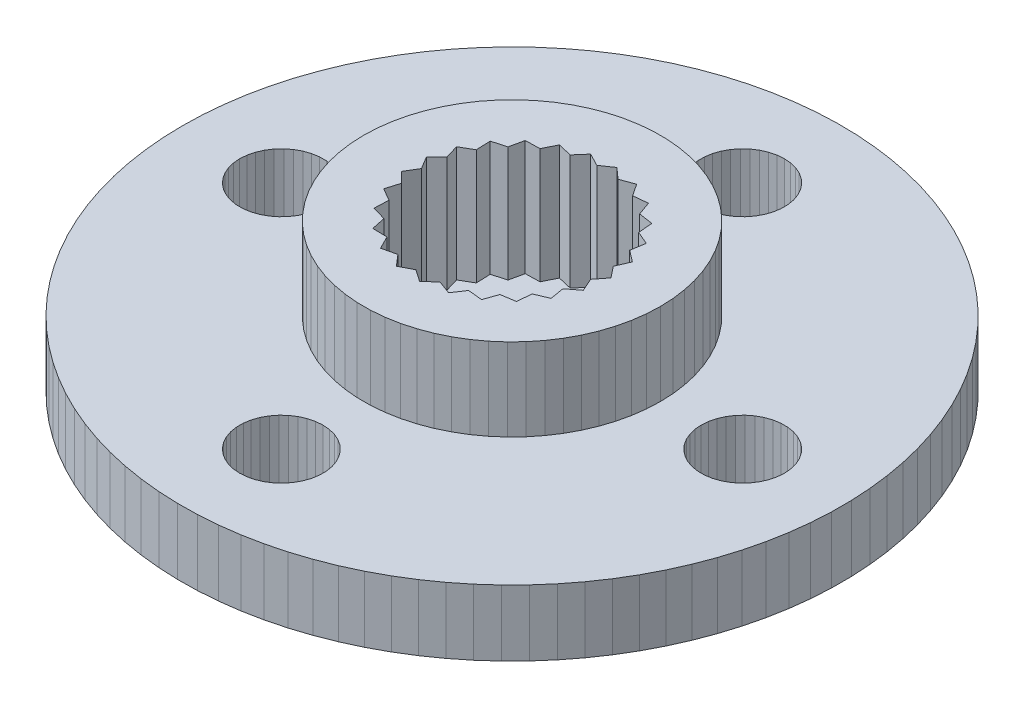
from build123d import *

# Parameters (mm, degrees)
BOSS_EXTRUDE1_DEPTH = 2.000000095
CUT_EXTRUDE1_DEPTH  = 15.28207346
CUT_EXTRUDE2_DEPTH  = 15.28207346
CUT_EXTRUDE3_DEPTH  = 15.28207346
CUT_EXTRUDE4_DEPTH  = 15.28207346
BOSS_EXTRUDE2_DEPTH = 2.499999711
CUT_EXTRUDE5_DEPTH  = 3.499999759
CUT_EXTRUDE6_DEPTH  = 15.568034193


with BuildPart() as part:
    # Sketch1 → Boss-Extrude1 (new body)
    with BuildSketch(Plane.XZ):
        Polygon((9.995524772, -0.299154664), (9.995524772, 0.299154664), (9.959742427, 0.896393089), (9.888308123, 1.490422641), (9.78147611, 2.079116879), (9.639628232, 2.660368336), (9.46327392, 3.232096788), (9.25304275, 3.79225472), (9.009688161, 4.338837694), (8.734081872, 4.869888537), (8.427210152, 5.383506417), (8.0901701, 5.87785244), (7.724169642, 6.351157557), (7.330518682, 6.801727228), (6.910626311, 7.227948867), (6.465995684, 7.628296036), (5.998218898, 8.001334965), (5.508970004, 8.345732465), (4.999999888, 8.660254069), (4.473131616, 8.943773806), (3.930250183, 9.195278399), (3.373299725, 9.413865395), (2.804273739, 9.598752484), (2.22520926, 9.749279357), (1.638179063, 9.864905849), (1.045284676, 9.945219383), (0.448648294, 9.989931248), (-0.149594067, 9.998881258), (-0.747300917, 9.972038679), (-1.342332573, 9.909497574), (-1.932559186, 9.811483324), (-2.515867818, 9.678347968), (-3.090169979, 9.510564618), (-3.653410124, 9.308737703), (-4.203572404, 9.073587134), (-4.738686606, 8.805954829), (-5.2568377, 8.506800979), (-5.756170955, 8.177193813), (-6.234898232, 7.818315178), (-6.691305898, 7.431448437), (-7.123761345, 7.017978933), (-7.530714385, 6.579387002), (-7.910710759, 6.117242854), (-8.262387477, 5.633200519), (-8.584488183, 5.128992721), (-8.875858039, 4.606424365), (-9.135453962, 4.067366477), (-9.362348355, 3.513748059), (-9.555728175, 2.947551664), (-9.714899585, 2.37080385), (-9.839296341, 1.785569009), (-9.928469546, 1.193942153), (-9.982101619, 0.598041515), (-9.999999776, 0), (-9.982101619, -0.598041515), (-9.928469546, -1.193942153), (-9.839296341, -1.785569009), (-9.714899585, -2.37080385), (-9.555728175, -2.947551664), (-9.362348355, -3.513748059), (-9.135453962, -4.067366477), (-8.875858039, -4.606424365), (-8.584488183, -5.128992721), (-8.262387477, -5.633200519), (-7.910710759, -6.117242854), (-7.530714385, -6.579387002), (-7.123761345, -7.017978933), (-6.691305898, -7.431448437), (-6.234898232, -7.818315178), (-5.756170955, -8.177193813), (-5.2568377, -8.506800979), (-4.738686606, -8.805954829), (-4.203572404, -9.073587134), (-3.653410124, -9.308737703), (-3.090169979, -9.510564618), (-2.515867818, -9.678347968), (-1.932559186, -9.811483324), (-1.342332573, -9.909497574), (-0.747300917, -9.972038679), (-0.149594067, -9.998881258), (0.448648294, -9.989931248), (1.045284676, -9.945219383), (1.638179063, -9.864905849), (2.22520926, -9.749279357), (2.804273739, -9.598752484), (3.373299725, -9.413865395), (3.930250183, -9.195278399), (4.473131616, -8.943773806), (4.999999888, -8.660254069), (5.508970004, -8.345732465), (5.998218898, -8.001334965), (6.465995684, -7.628296036), (6.910626311, -7.227948867), (7.330518682, -6.801727228), (7.724169642, -6.351157557), (8.0901701, -5.87785244), (8.427210152, -5.383506417), (8.734081872, -4.869888537), (9.009688161, -4.338837694), (9.25304275, -3.79225472), (9.46327392, -3.232096788), (9.639628232, -2.660368336), (9.78147611, -2.079116879), (9.888308123, -1.490422641), (9.959742427, -0.896393089), align=None)
    extrude(amount=-BOSS_EXTRUDE1_DEPTH)

    # Sketch2 → Cut-Extrude1 (cut, through all)
    with BuildSketch(Plane(origin=(0, 2.000000095, 0), x_dir=(-1, 0, 0), z_dir=(0, 1, 0))):
        Polygon((-7.507943548, 1.157995313), (-7.691616192, 1.058597001), (-7.856422104, 0.930322858), (-7.997867651, 0.776671921), (-8.112095296, 0.601835491), (-8.19598604, 0.410582492), (-8.247253485, 0.208129859), (-8.264499716, 0), (-8.247253485, -0.208129859), (-8.19598604, -0.410582492), (-8.112095296, -0.601835491), (-7.997867651, -0.776671921), (-7.856422104, -0.930322858), (-7.691616192, -1.058597001), (-7.507943548, -1.157995313), (-7.310416084, -1.22580654), (-7.1044215, -1.260181074), (-6.895578466, -1.260181074), (-6.689583883, -1.22580654), (-6.492056418, -1.157995313), (-6.308383774, -1.058597001), (-6.143577397, -0.930322858), (-6.00213185, -0.776671921), (-5.887905601, -0.601835491), (-5.804014392, -0.410582492), (-5.752746016, -0.208129859), (-5.735499784, 0), (-5.752746016, 0.208129859), (-5.804014392, 0.410582492), (-5.887905601, 0.601835491), (-6.00213185, 0.776671921), (-6.143577397, 0.930322858), (-6.308383774, 1.058597001), (-6.492056418, 1.157995313), (-6.689583883, 1.22580654), (-6.895578466, 1.260181074), (-7.1044215, 1.260181074), (-7.310416084, 1.22580654), align=None)
    extrude(amount=-CUT_EXTRUDE1_DEPTH, mode=Mode.SUBTRACT)

    # Sketch3 → Cut-Extrude2 (cut, through all)
    with BuildSketch(Plane(origin=(0, 2.000000095, 0), x_dir=(-1, 0, 0), z_dir=(0, 1, 0))):
        Polygon((-0.208129859, 8.247253485), (-0.410582492, 8.19598604), (-0.601835491, 8.112095296), (-0.776671921, 7.997867651), (-0.930322858, 7.856422104), (-1.058597001, 7.691616192), (-1.157995313, 7.507943548), (-1.22580654, 7.310416084), (-1.260181074, 7.1044215), (-1.260181074, 6.895578466), (-1.22580654, 6.689583883), (-1.157995313, 6.492056418), (-1.058597001, 6.308383774), (-0.930322858, 6.143577397), (-0.776671921, 6.00213185), (-0.601835491, 5.887905601), (-0.410582492, 5.804014392), (-0.208129859, 5.752746016), (0, 5.735499784), (0.208129859, 5.752746016), (0.410582492, 5.804014392), (0.601835491, 5.887905601), (0.776671921, 6.00213185), (0.930322858, 6.143577397), (1.058597001, 6.308383774), (1.157995313, 6.492056418), (1.22580654, 6.689583883), (1.260181074, 6.895578466), (1.260181074, 7.1044215), (1.22580654, 7.310416084), (1.157995313, 7.507943548), (1.058597001, 7.691616192), (0.930322858, 7.856422104), (0.776671921, 7.997867651), (0.601835491, 8.112095296), (0.410582492, 8.19598604), (0.208129859, 8.247253485), (0, 8.264499716), align=None)
    extrude(amount=-CUT_EXTRUDE2_DEPTH, mode=Mode.SUBTRACT)

    # Sketch4 → Cut-Extrude3 (cut, through all)
    with BuildSketch(Plane(origin=(0, 2.000000095, 0), x_dir=(-1, 0, 0), z_dir=(0, 1, 0))):
        Polygon((6.689583883, 1.22580654), (6.492056418, 1.157995313), (6.308383774, 1.058597001), (6.143577397, 0.930322858), (6.00213185, 0.776671921), (5.887905601, 0.601835491), (5.804014392, 0.410582492), (5.752746016, 0.208129859), (5.735499784, 0), (5.752746016, -0.208129859), (5.804014392, -0.410582492), (5.887905601, -0.601835491), (6.00213185, -0.776671921), (6.143577397, -0.930322858), (6.308383774, -1.058597001), (6.492056418, -1.157995313), (6.689583883, -1.22580654), (6.895578466, -1.260181074), (7.1044215, -1.260181074), (7.310416084, -1.22580654), (7.507943548, -1.157995313), (7.691616192, -1.058597001), (7.856422104, -0.930322858), (7.997867651, -0.776671921), (8.112095296, -0.601835491), (8.19598604, -0.410582492), (8.247253485, -0.208129859), (8.264499716, 0), (8.247253485, 0.208129859), (8.19598604, 0.410582492), (8.112095296, 0.601835491), (7.997867651, 0.776671921), (7.856422104, 0.930322858), (7.691616192, 1.058597001), (7.507943548, 1.157995313), (7.310416084, 1.22580654), (7.1044215, 1.260181074), (6.895578466, 1.260181074), align=None)
    extrude(amount=-CUT_EXTRUDE3_DEPTH, mode=Mode.SUBTRACT)

    # Sketch5 → Cut-Extrude4 (cut, through all)
    with BuildSketch(Plane.XZ):
        Polygon((0, -5.735499784), (-0.208129859, -5.752746016), (-0.410582492, -5.804014392), (-0.601835491, -5.887905601), (-0.776671921, -6.00213185), (-0.930322858, -6.143577397), (-1.058597001, -6.308383774), (-1.157995313, -6.492056418), (-1.22580654, -6.689583883), (-1.260181074, -6.895578466), (-1.260181074, -7.1044215), (-1.22580654, -7.310416084), (-1.157995313, -7.507943548), (-1.058597001, -7.691616192), (-0.930322858, -7.856422104), (-0.776671921, -7.997867651), (-0.601835491, -8.112095296), (-0.410582492, -8.19598604), (-0.208129859, -8.247253485), (0, -8.264499716), (0.208129859, -8.247253485), (0.410582492, -8.19598604), (0.601835491, -8.112095296), (0.776671921, -7.997867651), (0.930322858, -7.856422104), (1.058597001, -7.691616192), (1.157995313, -7.507943548), (1.22580654, -7.310416084), (1.260181074, -7.1044215), (1.260181074, -6.895578466), (1.22580654, -6.689583883), (1.157995313, -6.492056418), (1.058597001, -6.308383774), (0.930322858, -6.143577397), (0.776671921, -6.00213185), (0.601835491, -5.887905601), (0.410582492, -5.804014392), (0.208129859, -5.752746016), align=None)
    extrude(amount=-CUT_EXTRUDE4_DEPTH, mode=Mode.SUBTRACT)

    # Sketch6 → Boss-Extrude2 (add)
    with BuildSketch(Plane(origin=(0, 2.000000095, 0), x_dir=(-1, 0, 0), z_dir=(0, 1, 0))):
        Polygon((-4.481884651, -0.403376878), (-4.499999806, 0), (-4.481884651, 0.403376878), (-4.42768354, 0.803506002), (-4.337832797, 1.19716581), (-4.213056993, 1.581186661), (-4.054360092, 1.952476916), (-3.863019403, 2.308046911), (-3.640576266, 2.645033645), (-3.388821613, 2.96072429), (-3.109782003, 3.252576804), (-2.805704018, 3.51824169), (-2.479036339, 3.755579703), (-2.132409019, 3.962679766), (-1.768612652, 4.137875047), (-1.390576479, 4.279754125), (-1.001344179, 4.387175664), (-0.60404971, 4.459274001), (-0.201891729, 4.495468456), (0.201891729, 4.495468456), (0.60404971, 4.459274001), (1.001344179, 4.387175664), (1.390576479, 4.279754125), (1.768612652, 4.137875047), (2.132409019, 3.962679766), (2.479036339, 3.755579703), (2.805704018, 3.51824169), (3.109782003, 3.252576804), (3.388821613, 2.96072429), (3.640576266, 2.645033645), (3.863019403, 2.308046911), (4.054360092, 1.952476916), (4.213056993, 1.581186661), (4.337832797, 1.19716581), (4.42768354, 0.803506002), (4.481884651, 0.403376878), (4.499999806, 0), (4.481884651, -0.403376878), (4.42768354, -0.803506002), (4.337832797, -1.19716581), (4.213056993, -1.581186661), (4.054360092, -1.952476916), (3.863019403, -2.308046911), (3.640576266, -2.645033645), (3.388821613, -2.96072429), (3.109782003, -3.252576804), (2.805704018, -3.51824169), (2.479036339, -3.755579703), (2.132409019, -3.962679766), (1.768612652, -4.137875047), (1.390576479, -4.279754125), (1.001344179, -4.387175664), (0.60404971, -4.459274001), (0.201891729, -4.495468456), (-0.201891729, -4.495468456), (-0.60404971, -4.459274001), (-1.001344179, -4.387175664), (-1.390576479, -4.279754125), (-1.768612652, -4.137875047), (-2.132409019, -3.962679766), (-2.479036339, -3.755579703), (-2.805704018, -3.51824169), (-3.109782003, -3.252576804), (-3.388821613, -2.96072429), (-3.640576266, -2.645033645), (-3.863019403, -2.308046911), (-4.054360092, -1.952476916), (-4.213056993, -1.581186661), (-4.337832797, -1.19716581), (-4.42768354, -0.803506002), align=None)
    extrude(amount=BOSS_EXTRUDE2_DEPTH)

    # Sketch7 → Cut-Extrude5 (cut)
    with BuildSketch(Plane(origin=(0, 4.499999806, 0), x_dir=(-1, 0, 0), z_dir=(0, 1, 0))):
        Polygon((-2.728315303, 0.34466639), (-3.000000026, 0), (-2.728315303, -0.34466639), (-2.905749483, -0.746069651), (-2.556885127, -1.012342516), (-2.628920134, -1.445260947), (-2.224796684, -1.616409398), (-2.186905826, -2.053641248), (-1.752916025, -2.118911594), (-1.607480459, -2.532983664), (-1.170893083, -2.48827436), (-0.927051005, -2.853169339), (-0.515298627, -2.701289952), (-0.188371559, -2.994080074), (0.172673928, -2.744573634), (0.56214392, -2.946861787), (0.849796692, -2.615405247), (1.277337899, -2.714481205), (1.473523793, -2.321901731), (1.912271953, -2.311539603), (2.004663693, -1.882504555), (2.427051077, -1.763355685), (2.409843495, -1.324822544), (2.789329505, -1.104373718), (2.663603751, -0.683897175), (2.9763442, -0.375999691), (2.749999985, 0), (2.9763442, 0.375999691), (2.663603751, 0.683897175), (2.789329505, 1.104373718), (2.409843495, 1.324822544), (2.427051077, 1.763355685), (2.004663693, 1.882504555), (1.912271953, 2.311539603), (1.473523793, 2.321901731), (1.277337899, 2.714481205), (0.849796692, 2.615405247), (0.56214392, 2.946861787), (0.172673928, 2.744573634), (-0.188371559, 2.994080074), (-0.515298627, 2.701289952), (-0.927051005, 2.853169339), (-1.170893083, 2.48827436), (-1.607480459, 2.532983664), (-1.752916025, 2.118911594), (-2.186905826, 2.053641248), (-2.224796684, 1.616409398), (-2.628920134, 1.445260947), (-2.556885127, 1.012342516), (-2.905749483, 0.746069651), align=None)
    extrude(amount=-CUT_EXTRUDE5_DEPTH, mode=Mode.SUBTRACT)

    # Sketch8 → Cut-Extrude6 (cut, through all)
    with BuildSketch(Plane(origin=(0, 1.000000047, 0), x_dir=(-1, 0, 0), z_dir=(0, 1, 0))):
        Polygon((-1.460543135, -0.34178028), (-1.391253667, -0.560725632), (-1.289354404, -0.766528014), (-1.157233724, -0.95436367), (-0.997988507, -1.119829831), (-0.815351319, -1.25904812), (-0.613602926, -1.368755475), (-0.397472264, -1.44638028), (-0.172025146, -1.490103081), (0.057454101, -1.49889919), (0.285586662, -1.472562435), (0.507025281, -1.411710051), (0.716579729, -1.317768358), (0.909338123, -1.192939235), (1.080782386, -1.040148782), (1.226893975, -0.862977991), (1.344248303, -0.665579748), (1.430094591, -0.452580891), (1.482420717, -0.22897392), (1.500000013, 0), (1.482420717, 0.22897392), (1.430094591, 0.452580891), (1.344248303, 0.665579748), (1.226893975, 0.862977991), (1.080782386, 1.040148782), (0.909338123, 1.192939235), (0.716579729, 1.317768358), (0.507025281, 1.411710051), (0.285586662, 1.472562435), (0.057454101, 1.49889919), (-0.172025146, 1.490103081), (-0.397472264, 1.44638028), (-0.613602926, 1.368755475), (-0.815351319, 1.25904812), (-0.997988507, 1.119829831), (-1.157233724, 0.95436367), (-1.289354404, 0.766528014), (-1.391253667, 0.560725632), (-1.460543135, 0.34178028), (-1.495598699, 0.114823881), (-1.495598699, -0.114823881), align=None)
    extrude(amount=-CUT_EXTRUDE6_DEPTH, mode=Mode.SUBTRACT)


solid = part.part
